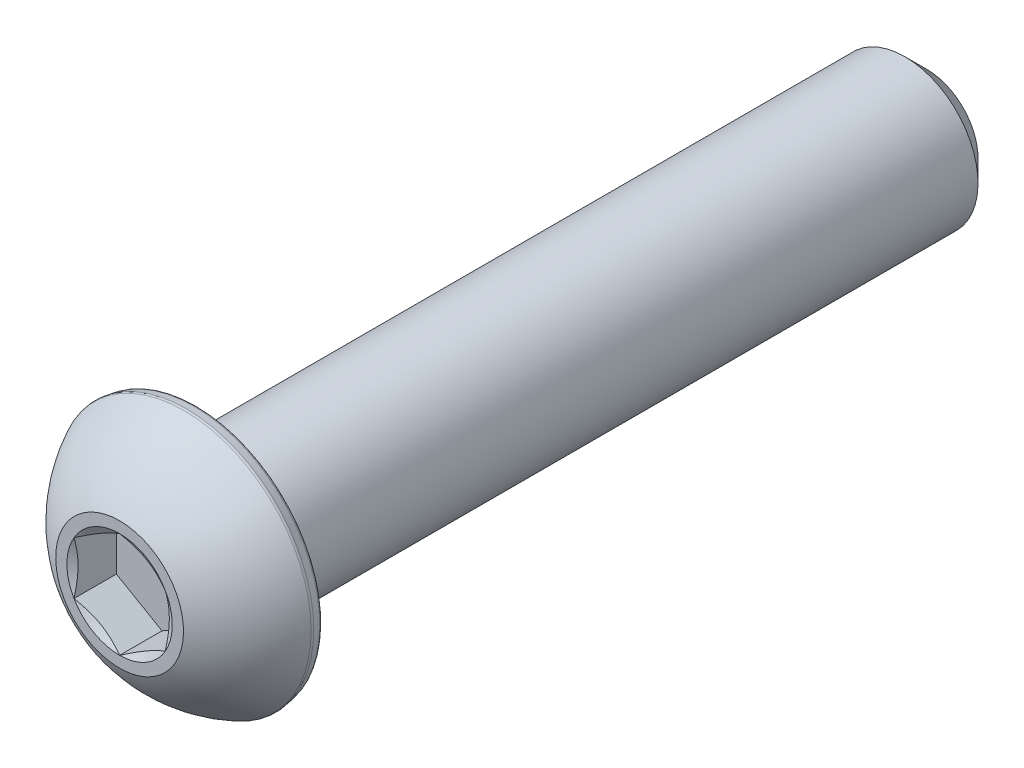
from build123d import *

# Parameters (mm, degrees)
CUT_EXTRUDE1_DEPTH = 1.84404
FILLET1_R          = 0.16764


with BuildPart() as part:
    # Sketch2 → Revolve1 (revolve)
    with BuildSketch(Plane(origin=(0, 0, 0), x_dir=(0, 0, -1), z_dir=(1, 0, 0))):
        with BuildLine():
            Line((31.75, 0), (-3.3528, 0))
            Line((-3.3528, 0), (-3.3528, 2.778125))
            ThreePointArc((-3.3528, 2.778125), (-2.158424687, 4.401074199), (-0.50292, 5.5499))
            Line((-0.50292, 5.5499), (0, 5.461221635))
            Line((0, 5.461221635), (0, 3.175))
            Line((0, 3.175), (30.7975, 3.175))
            Line((30.7975, 3.175), (31.75, 2.2225))
            Line((31.75, 2.2225), (31.75, 0))
        make_face()
    revolve(axis=Axis((0, 0, -31.75), (0, 0, 1)))

    # Sketch3 → Cut-Extrude1 (cut)
    with BuildSketch(Plane.XY.offset(3.3528)):
        Polygon((0, 2.291358881), (-1.984375, 1.14567944), (-1.984375, -1.14567944), (0, -2.291358881), (1.984375, -1.14567944), (1.984375, 1.14567944), align=None)
    extrude(amount=-CUT_EXTRUDE1_DEPTH, mode=Mode.SUBTRACT)

    # Cut-Extrude2 cone 1 section (through the dimple's axis) → Cut-Extrude2 (revolve, cut)
    with BuildSketch(Plane(origin=(0, 0, 3.3528), x_dir=(0, -1, 0), z_dir=(1, 0, 0))):
        Polygon((0, 0), (2.291358881, 0), (0, 1.322916667), align=None)
    revolve(axis=Axis((0, 0, 3.3528), (0, 0, -1)), mode=Mode.SUBTRACT)

    # Fillet1
    fillet1_edges = [part.edges().sort_by_distance(p)[0] for p in [
        (0, -5.5499, 0.50292),
        (0, -5.461221635, 0),
    ]]
    fillet(fillet1_edges, radius=FILLET1_R)


solid = part.part
